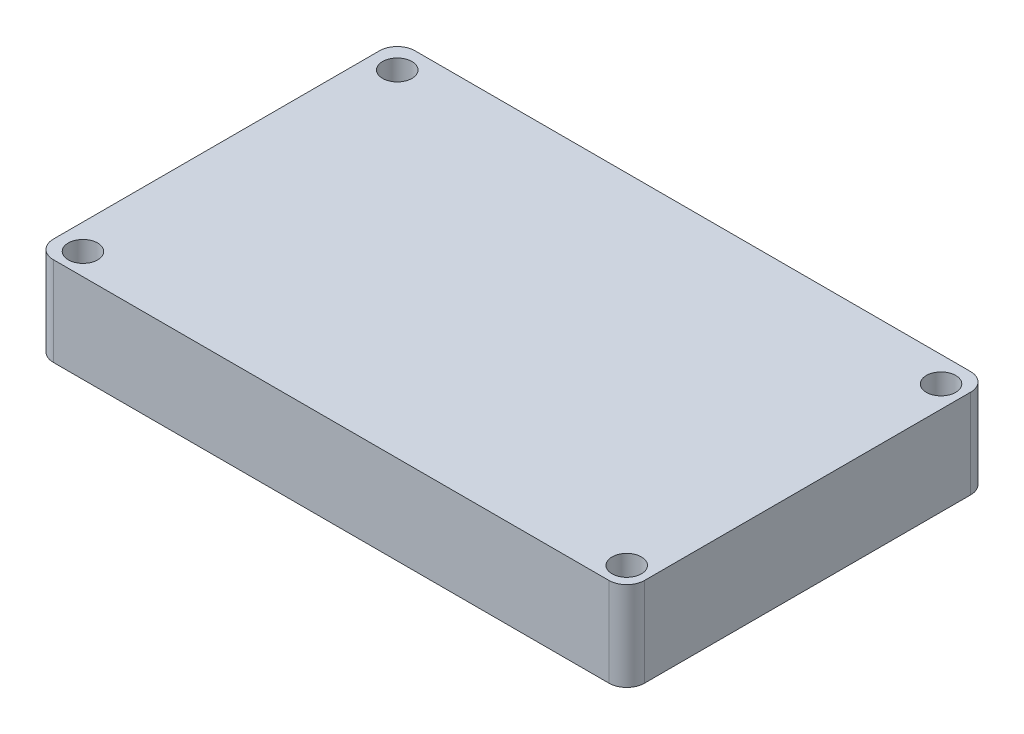
from build123d import *

# Parameters (mm, degrees)
SKETCH1_W           = 66.42
SKETCH1_H           = 40.64
BOSS_EXTRUDE1_DEPTH = 10
SKETCH2_R           = 1.65
CUT_EXTRUDE1_DEPTH  = 10
FILLET1_R           = 2


with BuildPart() as part:
    # Sketch1 → Boss-Extrude1 (new body)
    with BuildSketch(Plane(origin=(0, 0, 0), x_dir=(1, 0, 0), z_dir=(0, 1, 0))):
        with Locations((33.21, 20.32)):
            Rectangle(SKETCH1_W, SKETCH1_H)
    extrude(amount=BOSS_EXTRUDE1_DEPTH)

    # Sketch2 → Cut-Extrude1 (cut)
    with BuildSketch(Plane(origin=(0, 10, 0), x_dir=(1, 0, 0), z_dir=(0, 1, 0))):
        with Locations(Location((63.955, 2.465, 0), (0, 0, 270))):
            Circle(SKETCH2_R)
        with Locations(Location((63.955, 37.775, 0), (0, 0, 270))):
            Circle(SKETCH2_R)
        with Locations(Location((2.865, 37.775, 0), (0, 0, 270))):
            Circle(SKETCH2_R)
        with Locations(Location((2.865, 2.465, 0), (0, 0, 270))):
            Circle(SKETCH2_R)
    extrude(amount=-CUT_EXTRUDE1_DEPTH, mode=Mode.SUBTRACT)

    # Fillet1
    fillet1_edges = [part.edges().sort_by_distance(p)[0] for p in [
        (0, 5, -40.64),
        (66.42, 5, -40.64),
        (66.42, 5, 0),
        (0, 5, 0),
    ]]
    fillet(fillet1_edges, radius=FILLET1_R)


solid = part.part
